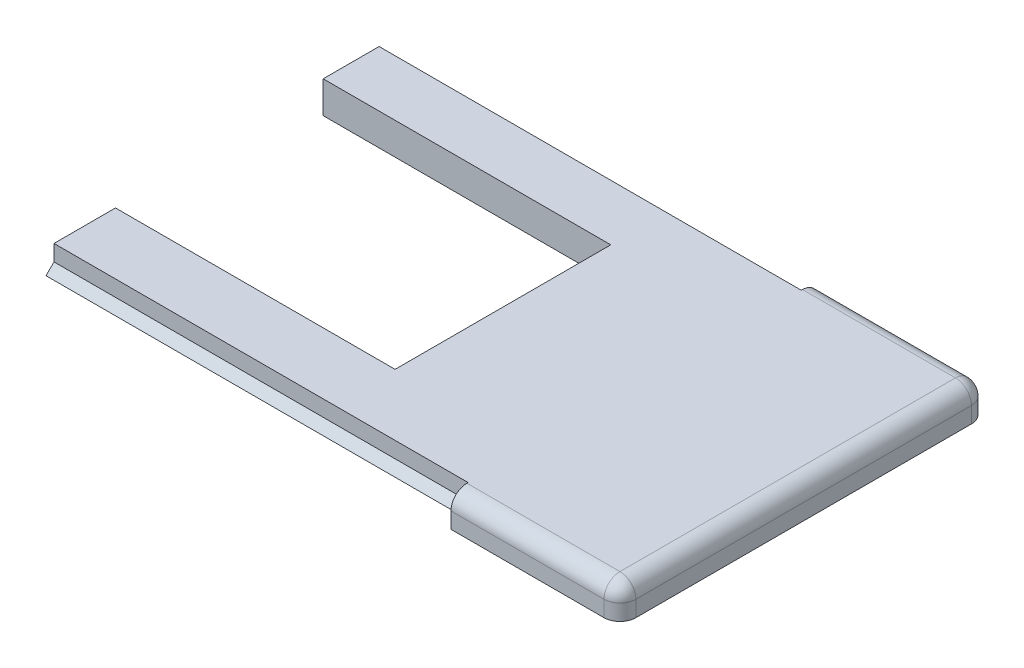
from build123d import *

# Parameters (mm, degrees)
EXTRUDE_2_DEPTH     = 4
EXTRUDE_3_DEPTH     = 51.85
EXTRUDE_4_DEPTH     = 51.85
SKETCH_6_W          = 32
SKETCH_6_H          = 27
SKETCH_6_W_2        = 3
CUT_EXTRUDE_1_DEPTH = 4
SKETCH_7_W          = 46
SKETCH_7_H          = 4
EXTRUDE_5_DEPTH     = 1.15
EXTRUDE_6_DEPTH     = 5
EXTRUDE_7_DEPTH     = 1
FILLET_3_R          = 2


with BuildPart() as part:
    # 草图1 → 凸台-拉伸2 (new body)
    with BuildSketch(Plane(origin=(0, 0, 0), x_dir=(1, 0, 0), z_dir=(0, 1, 0))):
        Polygon((16.85, -20.85), (17, -20.85), (17, 20.85), (16.85, 20.85), (-34.85, 20.85), (-34.85, -20.85), align=None)
        Polygon((17, -20.85), (17, -21), (31, -21), (35, -21), (35, -18), (35, 18), (35, 21), (31, 21), (17, 21), (17, 20.85), align=None)
        Polygon((31, -21), (17, -21), (17, -23), (37, -23), (37, 23), (17, 23), (17, 21), (31, 21), (35, 21), (35, 18), (35, -18), (35, -21), align=None)
    extrude(amount=EXTRUDE_2_DEPTH)

    # 草图4 → 凸台-拉伸3 (add)
    with BuildSketch(Plane.ZY.offset(-17)):
        Polygon((-20.85, 2), (-21.85, 1), (-20.85, 0), align=None)
    extrude(amount=EXTRUDE_3_DEPTH)

    # 草图3 → 凸台-拉伸4 (add)
    with BuildSketch(Plane.ZY.offset(-17)):
        Polygon((20.85, 2), (21.85, 1), (20.85, 0), align=None)
    extrude(amount=EXTRUDE_4_DEPTH)

    # 草图6 → 切除-拉伸1 (cut)
    with BuildSketch(Plane(origin=(0, 4, 0), x_dir=(1, 0, 0), z_dir=(0, 1, 0))):
        with Locations((-15.85, 0.35)):
            Rectangle(SKETCH_6_W, SKETCH_6_H)
        with Locations((-33.35, 0.35)):
            Rectangle(SKETCH_6_W_2, SKETCH_6_H)
    extrude(amount=-CUT_EXTRUDE_1_DEPTH, mode=Mode.SUBTRACT)

    # 草图7 → 凸台-拉伸5 (add)
    with BuildSketch(Plane(origin=(37, 0, 0), x_dir=(0, 0, -1), z_dir=(1, 0, 0))):
        with Locations((0, 2)):
            Rectangle(SKETCH_7_W, SKETCH_7_H)
    extrude(amount=EXTRUDE_5_DEPTH)

    # 草图12 → 凸台-拉伸6 (add, symmetric)
    with BuildSketch(Plane.XY):
        Polygon((36.65, 0), (36.65, -0.75), (37.4, 0), align=None)
        Polygon((35.9, 0), (36.65, -0.75), (36.65, 0), align=None)
    extrude(amount=EXTRUDE_6_DEPTH, both=True)

    # 草图14 → 凸台-拉伸7 (add)
    with BuildSketch(Plane.ZY.offset(34.85)):
        Polygon((-13.85, 0), (-13.85, 4), (-20.85, 4), (-20.85, 2), (-21.85, 1), (-20.85, 0), align=None)
    extrude(amount=EXTRUDE_7_DEPTH)

    # 圆角3
    fillet_3_edges = [part.edges().sort_by_distance(p)[0] for p in [
        (27.575, 4, 23),
        (27.575, 4, -23),
        (38.15, 2, 23),
        (38.15, 2, -23),
        (38.15, 4, 0),
    ]]
    fillet(fillet_3_edges, radius=FILLET_3_R)


solid = part.part
